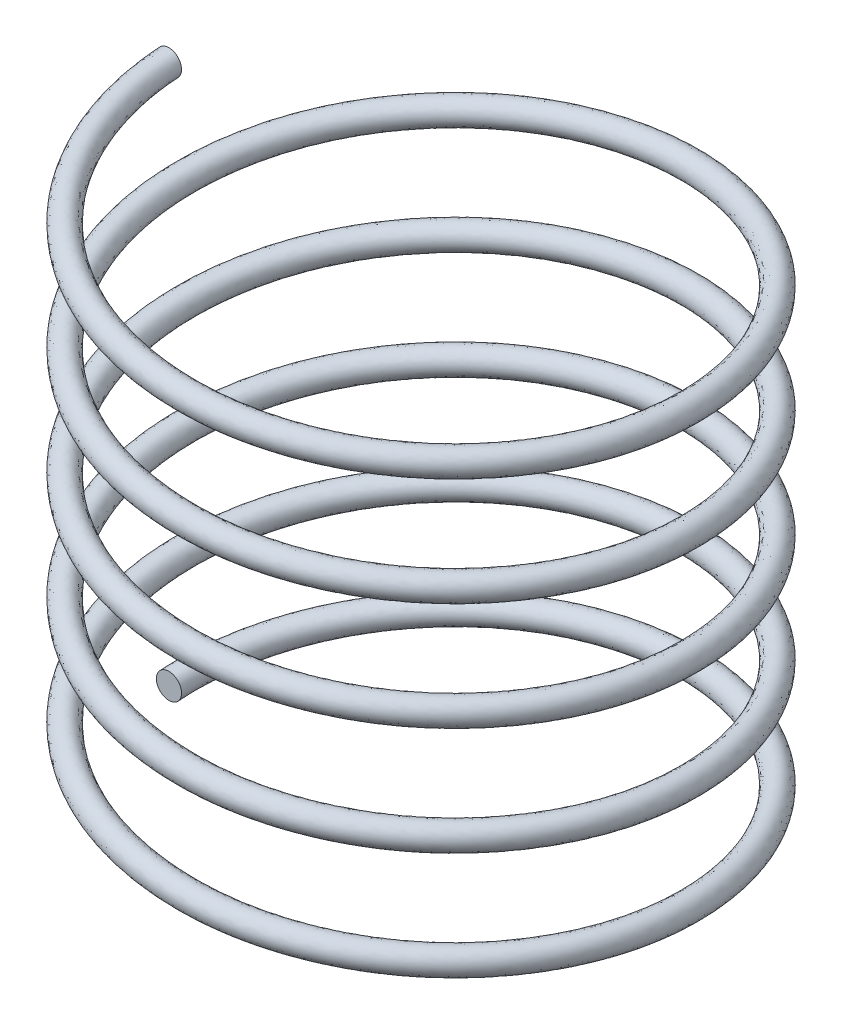
from build123d import *

# Parameters (mm, degrees)
SWEEP1_PITCH       = 3
SWEEP1_HEIGHT      = 15
SWEEP1_RADIUS      = 7.4
SWEEP1_START_ANGLE = -90
SKETCH1_R          = 0.35


with BuildPart() as part:
    # Sweep1: sweep along a helix
    with BuildLine() as sweep1_path:
        add(Helix(SWEEP1_PITCH, SWEEP1_HEIGHT, SWEEP1_RADIUS, center=(0, 0, 0), direction=(0, 1, 0), lefthand=True, mode=Mode.PRIVATE).rotate(Axis((0, 0, 0), (0, 1, 0)), SWEEP1_START_ANGLE))
    # Sketch1 → Sweep1 (sweep)
    with BuildSketch(Plane.XY):
        with Locations((-7, 0)):
            Circle(SKETCH1_R)
    sweep(path=sweep1_path.line, is_frenet=True)


solid = part.part
